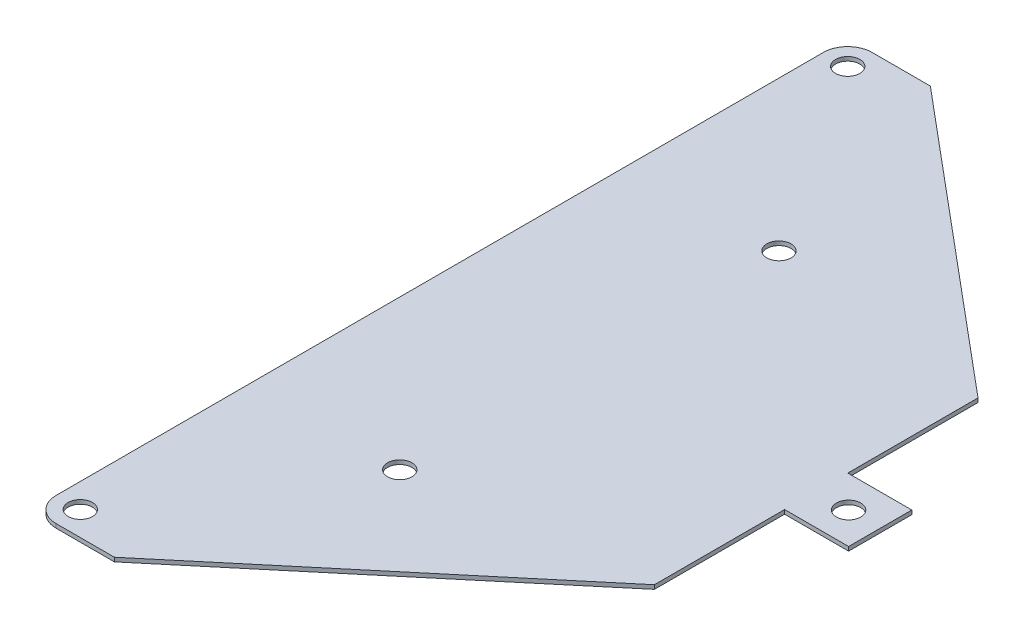
from build123d import *

# Parameters (mm, degrees)
CROQUIS1_R              = 1.5
SALIENTE_EXTRUIR1_DEPTH = 0.5


with BuildPart() as part:
    # Croquis1 → Saliente-Extruir1 (new body)
    with BuildSketch(Plane(origin=(0, 0, 0), x_dir=(1, 0, 0), z_dir=(0, 1, 0))):
        with BuildLine():
            Line((43.47, -43.46), (51.37, -43.46))
            Line((51.37, -43.46), (51.37, -51.26))
            Line((51.37, -51.26), (43.47, -51.26))
            Line((43.47, -51.26), (43.47, -67.33))
            Line((43.47, -67.33), (7.2, -97.72))
            Line((7.2, -97.72), (0, -97.72))
            ThreePointArc((0, -97.72), (-2.121320344, -96.841320344), (-3, -94.72))
            Line((-3, -94.72), (-3, 0))
            ThreePointArc((-3, 0), (-2.121320344, 2.121320344), (0, 3))
            Line((0, 3), (7.2, 3))
            Line((7.2, 3), (43.47, -27.39))
            Line((43.47, -27.39), (43.47, -43.46))
        make_face()
        with Locations(Location((0, 0, 0), (0, 0, 270))):
            Circle(CROQUIS1_R, mode=Mode.SUBTRACT)
        with Locations(Location((0, -94.72, 0), (0, 0, 270))):
            Circle(CROQUIS1_R, mode=Mode.SUBTRACT)
        with Locations(Location((47.47, -47.36, 0), (0, 0, 270))):
            Circle(CROQUIS1_R, mode=Mode.SUBTRACT)
        with Locations(Location((15.47, -23.96, 0), (0, 0, 270))):
            Circle(CROQUIS1_R, mode=Mode.SUBTRACT)
        with Locations(Location((15.47, -70.76, 0), (0, 0, 270))):
            Circle(CROQUIS1_R, mode=Mode.SUBTRACT)
    extrude(amount=SALIENTE_EXTRUIR1_DEPTH)


solid = part.part
